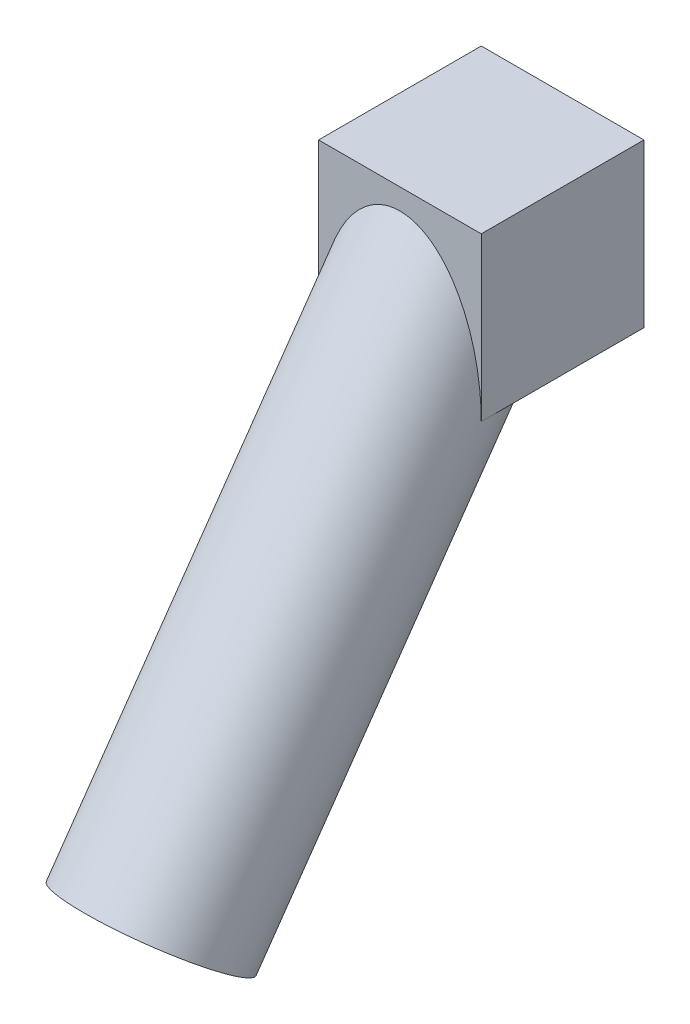
from build123d import *

# Parameters (mm, degrees)
SKETCH1_W                = 15
SKETCH1_H                = 15
BOSS_EXTRUDE1_DEPTH      = 15
BOSS_EXTRUDE2_DEPTH      = 40
BOSS_EXTRUDE2_DEPTH_BACK = 12
SKETCH2_R                = 7.5


with BuildPart() as part:
    # Sketch1 → Boss-Extrude1 (new body)
    with BuildSketch(Plane(origin=(0, 0, 0), x_dir=(1, 0, 0), z_dir=(0, 1, 0))):
        with Locations((7.5, 7.5)):
            Rectangle(SKETCH1_W, SKETCH1_H)
    extrude(amount=BOSS_EXTRUDE1_DEPTH)

    # Sketch2 → Boss-Extrude2 (add, two sides: drawn at the far end of the back side and taken through both)
    with BuildSketch(Plane(origin=(0, 0, 0), x_dir=(1, 0, 0), z_dir=(0, -0.8191520442889992, 0.5735764363510355)).offset(-BOSS_EXTRUDE2_DEPTH_BACK)):
        with Locations(Location((7.5, 0, 0), (0, 0, 270))):
            Circle(SKETCH2_R)
    extrude(amount=BOSS_EXTRUDE2_DEPTH + BOSS_EXTRUDE2_DEPTH_BACK)


solid = part.part
